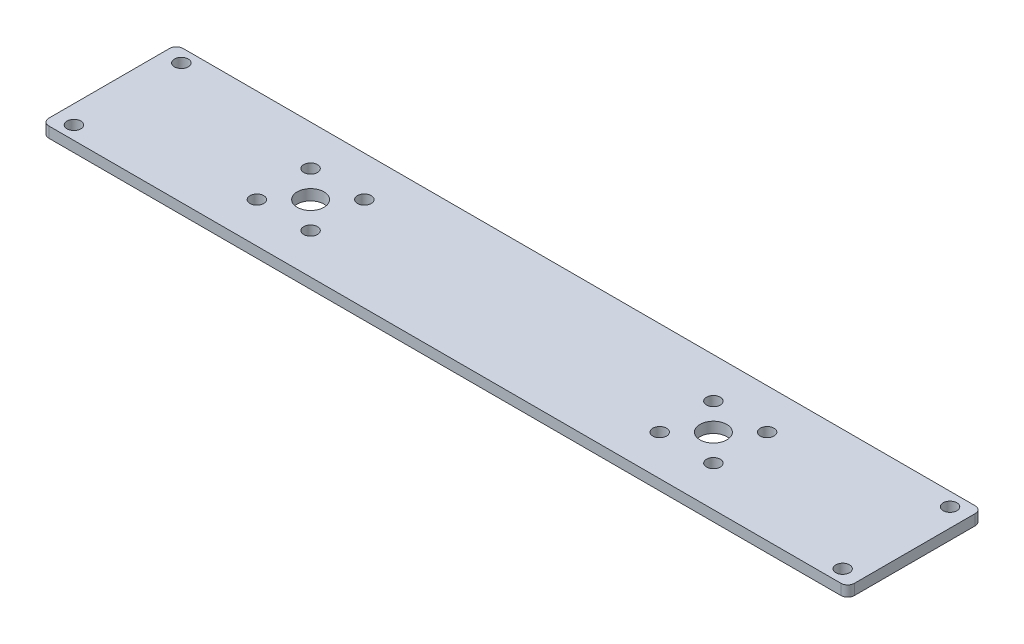
from build123d import *

# Parameters (mm, degrees)
SKETCH1_W           = 240
SKETCH1_H           = 40
SKETCH1_R           = 2.05
SKETCH1_R_2         = 4
BOSS_EXTRUDE1_DEPTH = 3.175
FILLET1_R           = 2


with BuildPart() as part:
    # Sketch1 → Boss-Extrude1 (new body)
    with BuildSketch(Plane(origin=(0, 0, 0), x_dir=(1, 0, 0), z_dir=(0, 1, 0))):
        Rectangle(SKETCH1_W, SKETCH1_H)
        with Locations(Location((114.5, 16, 0), (0, 0, 270))):
            Circle(SKETCH1_R, mode=Mode.SUBTRACT)
        with Locations(Location((114.5, -16, 0), (0, 0, 270))):
            Circle(SKETCH1_R, mode=Mode.SUBTRACT)
        with Locations(Location((-114.5, 16, 0), (0, 0, 270))):
            Circle(SKETCH1_R, mode=Mode.SUBTRACT)
        with Locations(Location((-114.5, -16, 0), (0, 0, 270))):
            Circle(SKETCH1_R, mode=Mode.SUBTRACT)
        with Locations(Location((-52, -8, 0), (0, 0, 270))):
            Circle(SKETCH1_R, mode=Mode.SUBTRACT)
        with Locations(Location((-68, -8, 0), (0, 0, 270))):
            Circle(SKETCH1_R, mode=Mode.SUBTRACT)
        with Locations(Location((-68, 8, 0), (0, 0, 270))):
            Circle(SKETCH1_R, mode=Mode.SUBTRACT)
        with Locations(Location((-52, 8, 0), (0, 0, 270))):
            Circle(SKETCH1_R, mode=Mode.SUBTRACT)
        with Locations(Location((-60, 0, 0), (0, 0, 270))):
            Circle(SKETCH1_R_2, mode=Mode.SUBTRACT)
        with Locations(Location((68, 8, 0), (0, 0, 90))):
            Circle(SKETCH1_R, mode=Mode.SUBTRACT)
        with Locations(Location((52, 8, 0), (0, 0, 90))):
            Circle(SKETCH1_R, mode=Mode.SUBTRACT)
        with Locations(Location((60, 0, 0), (0, 0, 90))):
            Circle(SKETCH1_R_2, mode=Mode.SUBTRACT)
        with Locations(Location((68, -8, 0), (0, 0, 90))):
            Circle(SKETCH1_R, mode=Mode.SUBTRACT)
        with Locations(Location((52, -8, 0), (0, 0, 90))):
            Circle(SKETCH1_R, mode=Mode.SUBTRACT)
    extrude(amount=BOSS_EXTRUDE1_DEPTH)

    # Fillet1
    fillet1_edges = [part.edges().sort_by_distance(p)[0] for p in [
        (120, 1.5875, 20),
        (-120, 1.5875, 20),
        (-120, 1.5875, -20),
        (120, 1.5875, -20),
    ]]
    fillet(fillet1_edges, radius=FILLET1_R)


solid = part.part
